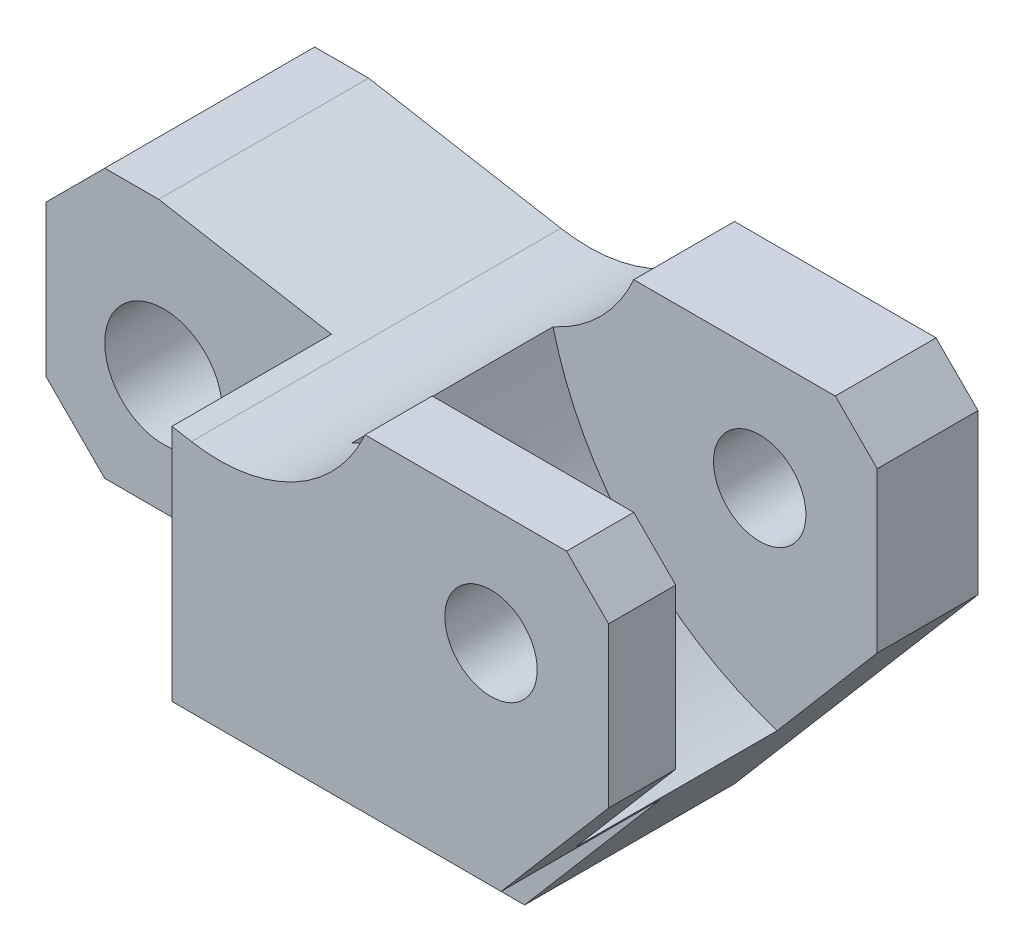
from build123d import *

# Parameters (mm, degrees)
SKETCH1_R           = 7
BOSS_EXTRUDE1_DEPTH = 44
SKETCH70_W          = 24
SKETCH70_H          = 39.803664443
SKETCH71_W          = 34
SKETCH71_H          = 19
CUT_EXTRUDE1_DEPTH  = 43
SKETCH73_R          = 5.5
CUT_EXTRUDE3_DEPTH  = 99.478424033
SKETCH75_W          = 19
SKETCH75_H          = 19
CUT_EXTRUDE4_DEPTH  = 105.177732746


with BuildPart() as part:
    # Sketch1 → Boss-Extrude1 (new body)
    with BuildSketch(Plane.XY):
        with BuildLine():
            Line((0, 0), (-7, 7))
            Line((-7, 7), (-7, 25))
            Line((-7, 25), (0, 32))
            Line((0, 32), (6.423127039, 32))
            Line((6.423127039, 32), (29.319429923, 27.962764043))
            ThreePointArc((29.319429923, 27.962764043), (41.564716358, 29.911963462), (50, 39))
            Line((50, 39), (74, 39))
            Line((74, 39), (79, 34))
            Line((79, 34), (79, 15))
            Line((79, 15), (50, -19))
            Line((50, -19), (44.788067397, -19))
            ThreePointArc((44.788067397, -19), (40.27095427, -12.128573817), (37.89327269, -4.256633834))
            ThreePointArc((37.89327269, -4.256633834), (36.210984968, -1.21075002), (32.948840798, 0))
            Line((32.948840798, 0), (0, 0))
        make_face()
        with Locations((7, 14)):
            Circle(SKETCH1_R, mode=Mode.SUBTRACT)
    extrude(amount=BOSS_EXTRUDE1_DEPTH)

    # Sketch70 → Cut-Revolve3 (revolve, cut)
    with BuildSketch(Plane(origin=(79, 0, 0), x_dir=(0, 0, -1), z_dir=(1, 0, 0))):
        with Locations((-24, 19.098167778)):
            Rectangle(SKETCH70_W, SKETCH70_H)
    revolve(axis=Axis((79, 39, 36), (0, 0, -1)), mode=Mode.SUBTRACT)

    # Sketch71 → Cut-Extrude1 (cut)
    with BuildSketch(Plane(origin=(0, 39, 0), x_dir=(1, 0, 0), z_dir=(0, 1, 0))):
        with Locations((10, -34.5)):
            Rectangle(SKETCH71_W, SKETCH71_H)
    extrude(amount=-CUT_EXTRUDE1_DEPTH, mode=Mode.SUBTRACT)

    # Sketch73 → Cut-Extrude3 (cut, through all)
    with BuildSketch(Plane.XY):
        with Locations(Location((65, 25, 0), (0, 0, 180))):
            Circle(SKETCH73_R)
    extrude(amount=CUT_EXTRUDE3_DEPTH, mode=Mode.SUBTRACT)

    # Sketch75 → Cut-Extrude4 (cut, through all)
    with BuildSketch(Plane(origin=(79, 0, 0), x_dir=(0, 0, -1), z_dir=(1, 0, 0))):
        with Locations((-34.5, -9.5)):
            Rectangle(SKETCH75_W, SKETCH75_H)
    extrude(amount=-CUT_EXTRUDE4_DEPTH, mode=Mode.SUBTRACT)


solid = part.part
